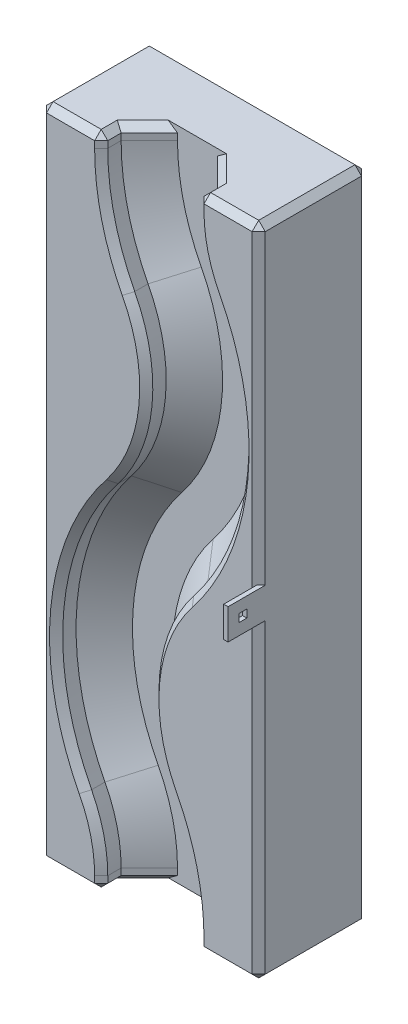
from build123d import *

# Parameters (mm, degrees)
SKETCH1_W                = 50
SKETCH1_H                = 150
BOSS_EXTRUDE1_DEPTH      = 25
CHAMFER1_SIZE            = 1.5
BOSS_EXTRUDE2_DEPTH      = 7
BOSS_EXTRUDE2_DEPTH_BACK = 10
SKETCH4_W                = 1
SKETCH4_H                = 7
SKETCH5_W                = 1.8
SKETCH5_H                = 1.8
CUT_EXTRUDE1_DEPTH       = 7


with BuildPart() as part:
    # Sketch1 → Boss-Extrude1 (new body)
    with BuildSketch(Plane.XY):
        with Locations((25, 75)):
            Rectangle(SKETCH1_W, SKETCH1_H)
    extrude(amount=BOSS_EXTRUDE1_DEPTH)

    # Cut-Sweep1: sweep along a path in Sketch3
    with BuildLine(Plane.XY.offset(25)) as cut_sweep1_path:
        Line((25, 0), (25, 3))
        ThreePointArc((25, 3), (23.751063127, 13.408967361), (20.075154476, 23.227019124))
        ThreePointArc((20.075154476, 23.227019124), (14.918298123, 49.838284764), (25, 75))
        ThreePointArc((25, 75), (35.081701877, 100.161715236), (29.924845524, 126.772980876))
        ThreePointArc((29.924845524, 126.772980876), (26.248936873, 136.591032639), (25, 147))
        Line((25, 147), (25, 150))
    # Sketch2 → Cut-Sweep1 (sweep, cut)
    with BuildSketch(Plane.XZ):
        Polygon((29.556349186, 36), (20.443650814, 36), (14, 29.556349186), (14, 20.443650814), (20.443650814, 14), (29.556349186, 14), (36, 20.443650814), (36, 29.556349186), align=None)
    sweep(path=cut_sweep1_path.line, mode=Mode.SUBTRACT)

    # Chamfer1
    chamfer1_edges = [part.edges().sort_by_distance(p)[0] for p in [
        (50, 75, 25),
        (43, 150, 25),
        (43, 0, 25),
        (7, 150, 25),
        (14, 1.5, 25),
        (13.063297345, 10.806725521, 25),
        (3.967729924, 50.879945025, 25),
        (24.131133677, 101.203375498, 25),
        (15.561171091, 133.988790799, 25),
        (14, 148.5, 25),
        (36, 1.5, 25),
        (34.438828909, 16.011209201, 25),
        (25.868866323, 48.796624502, 25),
        (46.032270076, 99.120054975, 25),
        (36.936702655, 139.193274479, 25),
        (36, 148.5, 25),
        (36, 150, 22.721825407),
        (14, 150, 22.721825407),
        (36, 0, 22.721825407),
        (14, 0, 22.721825407),
        (17.221825407, 0, 17.221825407),
        (32.778174593, 0, 17.221825407),
        (32.778174593, 150, 17.221825407),
        (17.221825407, 150, 17.221825407),
        (0, 75, 25),
        (25, 150, 0),
        (50, 75, 0),
        (25, 0, 0),
        (0, 75, 0),
        (7, 0, 25),
        (0, 150, 12.5),
        (50, 150, 12.5),
        (50, 0, 12.5),
        (0, 0, 12.5),
    ]]
    chamfer(chamfer1_edges, length=CHAMFER1_SIZE)

    # Sketch4 → Boss-Extrude2 (add, two sides: drawn at the far end of the back side and taken through both)
    with BuildSketch(Plane.XY.offset(25).offset(-BOSS_EXTRUDE2_DEPTH_BACK)):
        with Locations((49.5, 75)):
            Rectangle(SKETCH4_W, SKETCH4_H)
    extrude(amount=BOSS_EXTRUDE2_DEPTH + BOSS_EXTRUDE2_DEPTH_BACK)

    # Sketch5 → Cut-Extrude1 (cut)
    with BuildSketch(Plane(origin=(50, 0, 0), x_dir=(0, 0, -1), z_dir=(1, 0, 0))):
        with Locations((-28.6, 75)):
            Rectangle(SKETCH5_W, SKETCH5_H)
    extrude(amount=-CUT_EXTRUDE1_DEPTH, mode=Mode.SUBTRACT)


solid = part.part
